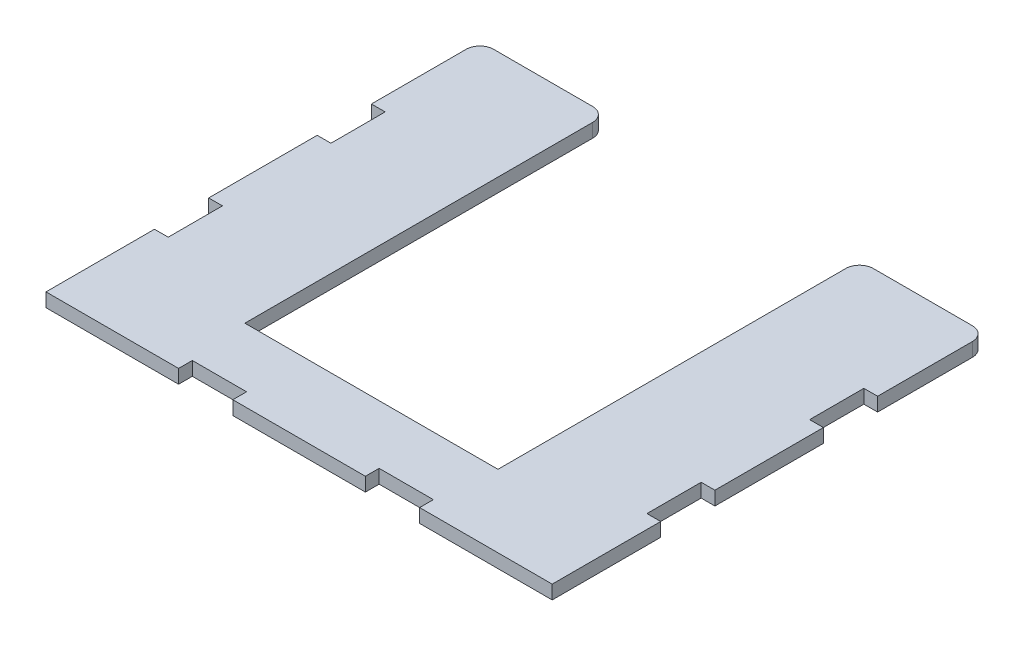
from build123d import *

# Parameters (mm, degrees)
SKETCH1_W             = 177.8
SKETCH1_H             = 152.4
BOSS_EXTRUDE1_DEPTH   = 4.826
SKETCH2_W             = 88.9
SKETCH2_H             = 127
CENTER_CUTOUT_DEPTH   = 235.22615199
SKETCH3_W             = 19.05
SKETCH3_H             = 4.826
BACK_EDGE_SLOTS_DEPTH = 235.22615199
SKETCH5_W             = 4.826
SKETCH5_H             = 19.05
SIDE_EDGE_SLOTS_DEPTH = 235.22615199
LEADING_EDGE_FILLET_R = 4.826


with BuildPart() as part:
    # Sketch1 → Boss-Extrude1 (new body)
    with BuildSketch(Plane(origin=(0, 0, 0), x_dir=(1, 0, 0), z_dir=(0, 1, 0))):
        with Locations((88.9, 76.2)):
            Rectangle(SKETCH1_W, SKETCH1_H)
    extrude(amount=BOSS_EXTRUDE1_DEPTH)

    # Sketch2 → Center Cutout (cut, through all)
    with BuildSketch(Plane(origin=(0, 4.826, 0), x_dir=(1, 0, 0), z_dir=(0, 1, 0))):
        with Locations((88.9, 88.9)):
            Rectangle(SKETCH2_W, SKETCH2_H)
    extrude(amount=-CENTER_CUTOUT_DEPTH, mode=Mode.SUBTRACT)

    # Sketch3 → Back Edge Slots (cut, through all)
    with BuildSketch(Plane(origin=(0, 4.826, 0), x_dir=(1, 0, 0), z_dir=(0, 1, 0))):
        with Locations((56.091666667, 2.413)):
            Rectangle(SKETCH3_W, SKETCH3_H)
        with Locations((121.708333333, 2.413)):
            Rectangle(SKETCH3_W, SKETCH3_H)
    extrude(amount=-BACK_EDGE_SLOTS_DEPTH, mode=Mode.SUBTRACT)

    # Sketch5 → Side Edge Slots (cut, through all)
    with BuildSketch(Plane(origin=(0, 4.826, 0), x_dir=(1, 0, 0), z_dir=(0, 1, 0))):
        with Locations((2.413, 104.775)):
            Rectangle(SKETCH5_W, SKETCH5_H)
        with Locations((2.413, 47.625)):
            Rectangle(SKETCH5_W, SKETCH5_H)
        with Locations((175.387, 104.775)):
            Rectangle(SKETCH5_W, SKETCH5_H)
        with Locations((175.387, 47.625)):
            Rectangle(SKETCH5_W, SKETCH5_H)
    extrude(amount=-SIDE_EDGE_SLOTS_DEPTH, mode=Mode.SUBTRACT)

    # Leading Edge Fillet
    leading_edge_fillet_edges = [part.edges().sort_by_distance(p)[0] for p in [
        (44.45, 2.413, -152.4),
        (133.35, 2.413, -152.4),
        (0, 2.413, -152.4),
        (177.8, 2.413, -152.4),
    ]]
    fillet(leading_edge_fillet_edges, radius=LEADING_EDGE_FILLET_R)


solid = part.part
